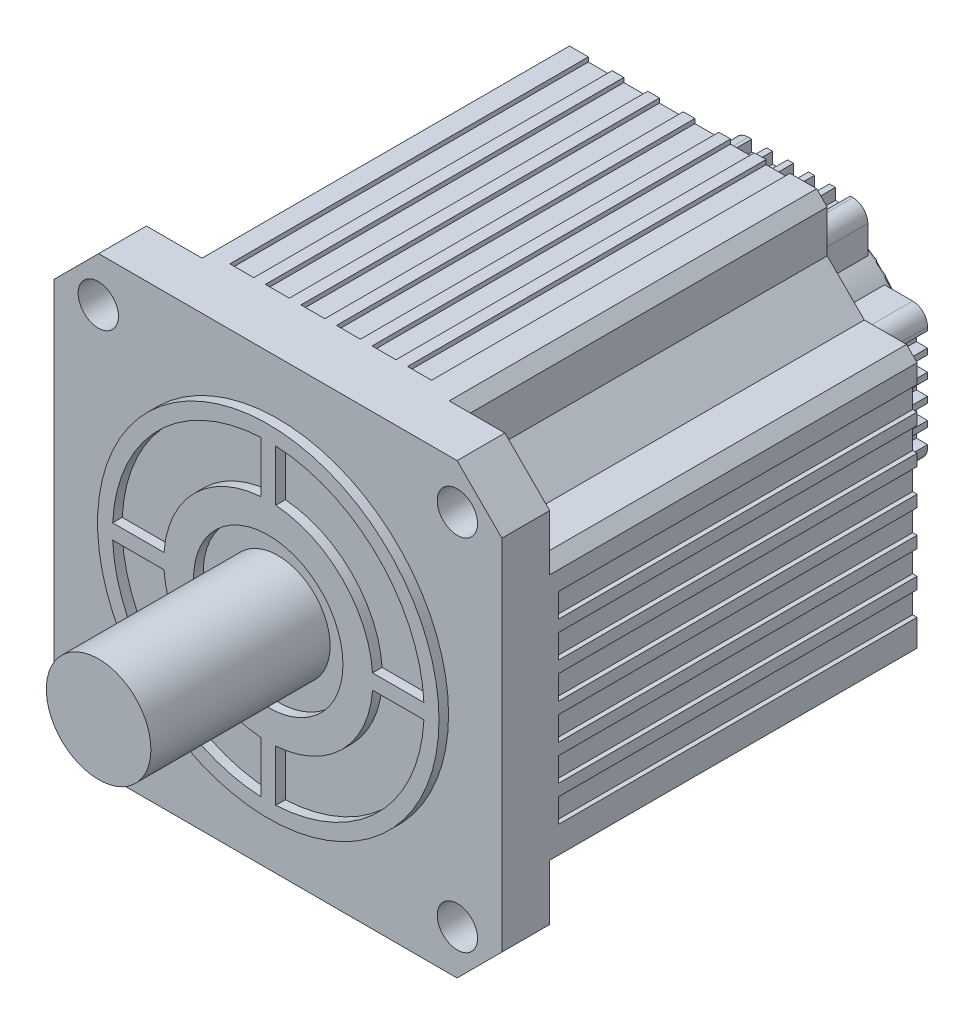
from build123d import *
from build123d.topology import SkipClean

# Parameters (mm, degrees)
EXTRUDE_1_DEPTH                     = 16
SKETCH_5_R                          = 57.15
EXTRUDE_2_DEPTH                     = 3.2
SKETCH_6_R                          = 52.15
CUT_EXTRUDE_3_DEPTH                 = 3.2
SKETCH_7_R                          = 17.5
EXTRUDE_4_DEPTH                     = 60
SKETCH_9_W                          = 29.28796894
SKETCH_9_H                          = 5
EXTRUDE_5_DEPTH                     = 3.2
PATTERN_CIRCULAR_1_COUNT            = 4
SKETCH_10_R                         = 35
SKETCH_10_R_2                       = 25
EXTRUDE_6_DEPTH                     = 3.2
EXTRUDE_7_DEPTH                     = 123
EXTRUDE_8_DEPTH                     = 36
SKETCH_13_R                         = 36.003209025
EXTRUDE_9_DEPTH                     = 2
FILLET_5_R                          = 1
SKETCH_14_W                         = 8
SKETCH_14_H                         = 13.851219487
CUT_EXTRUDE_10_DEPTH                = 120
SKETCH_15_W                         = 5
SKETCH_15_H                         = 4.986387051
CUT_EXTRUDE_11_DEPTH                = 44
PATTERN_LINEAR_4_COUNT              = 5
PATTERN_LINEAR_4_PITCH              = 7
EXTRUDE_12_DEPTH                    = 2
SKETCH_16_3_R                       = 1.5
EXTRUDE_13_DEPTH                    = 2
PATTERN_LINEAR_3_COUNT              = 6
PATTERN_LINEAR_3_PITCH              = 11.9
PATTERN_CIRCULAR_2_COUNT            = 4
PATTERN_CIRCULAR_2_COPY_1_SKETCH_W  = 8
PATTERN_CIRCULAR_2_COPY_1_SKETCH_H  = 13.851219487
PATTERN_CIRCULAR_2_COPY_1_DEPTH     = 120
PATTERN_CIRCULAR_2_COPY_2_SKETCH_W  = 8
PATTERN_CIRCULAR_2_COPY_2_SKETCH_H  = 13.851219487
PATTERN_CIRCULAR_2_COPY_2_DEPTH     = 120
PATTERN_CIRCULAR_2_COPY_3_SKETCH_W  = 8
PATTERN_CIRCULAR_2_COPY_3_SKETCH_H  = 13.851219487
PATTERN_CIRCULAR_2_COPY_3_DEPTH     = 120
PATTERN_CIRCULAR_2_COPY_4_SKETCH_W  = 8
PATTERN_CIRCULAR_2_COPY_4_SKETCH_H  = 13.851219487
PATTERN_CIRCULAR_2_COPY_4_DEPTH     = 120
PATTERN_CIRCULAR_2_COPY_5_SKETCH_W  = 8
PATTERN_CIRCULAR_2_COPY_5_SKETCH_H  = 13.851219487
PATTERN_CIRCULAR_2_COPY_5_DEPTH     = 120
PATTERN_CIRCULAR_2_COPY_6_SKETCH_W  = 8
PATTERN_CIRCULAR_2_COPY_6_SKETCH_H  = 13.851219487
PATTERN_CIRCULAR_2_COPY_6_DEPTH     = 120
PATTERN_CIRCULAR_2_COPY_7_SKETCH_W  = 8
PATTERN_CIRCULAR_2_COPY_7_SKETCH_H  = 13.851219487
PATTERN_CIRCULAR_2_COPY_7_DEPTH     = 120
PATTERN_CIRCULAR_2_COPY_8_SKETCH_W  = 8
PATTERN_CIRCULAR_2_COPY_8_SKETCH_H  = 13.851219487
PATTERN_CIRCULAR_2_COPY_8_DEPTH     = 120
PATTERN_CIRCULAR_2_COPY_9_SKETCH_W  = 8
PATTERN_CIRCULAR_2_COPY_9_SKETCH_H  = 13.851219487
PATTERN_CIRCULAR_2_COPY_9_DEPTH     = 120
PATTERN_CIRCULAR_2_COPY_10_SKETCH_W = 8
PATTERN_CIRCULAR_2_COPY_10_SKETCH_H = 13.851219487
PATTERN_CIRCULAR_2_COPY_10_DEPTH    = 120
PATTERN_CIRCULAR_2_COPY_11_SKETCH_W = 8
PATTERN_CIRCULAR_2_COPY_11_SKETCH_H = 13.851219487
PATTERN_CIRCULAR_2_COPY_11_DEPTH    = 120
PATTERN_CIRCULAR_2_COPY_12_SKETCH_W = 8
PATTERN_CIRCULAR_2_COPY_12_SKETCH_H = 13.851219487
PATTERN_CIRCULAR_2_COPY_12_DEPTH    = 120
PATTERN_CIRCULAR_2_COPY_13_SKETCH_W = 8
PATTERN_CIRCULAR_2_COPY_13_SKETCH_H = 13.851219487
PATTERN_CIRCULAR_2_COPY_13_DEPTH    = 120
PATTERN_CIRCULAR_2_COPY_14_SKETCH_W = 8
PATTERN_CIRCULAR_2_COPY_14_SKETCH_H = 13.851219487
PATTERN_CIRCULAR_2_COPY_14_DEPTH    = 120
PATTERN_CIRCULAR_2_COPY_15_SKETCH_W = 8
PATTERN_CIRCULAR_2_COPY_15_SKETCH_H = 13.851219487
PATTERN_CIRCULAR_2_COPY_15_DEPTH    = 120
PATTERN_CIRCULAR_3_COUNT            = 4
PATTERN_CIRCULAR_3_COPY_1_SKETCH_W  = 5
PATTERN_CIRCULAR_3_COPY_1_SKETCH_H  = 4.986387051
PATTERN_CIRCULAR_3_COPY_1_DEPTH     = 44
PATTERN_CIRCULAR_3_COPY_2_SKETCH_W  = 5
PATTERN_CIRCULAR_3_COPY_2_SKETCH_H  = 4.986387051
PATTERN_CIRCULAR_3_COPY_2_DEPTH     = 44
PATTERN_CIRCULAR_3_COPY_3_SKETCH_W  = 5
PATTERN_CIRCULAR_3_COPY_3_SKETCH_H  = 4.986387051
PATTERN_CIRCULAR_3_COPY_3_DEPTH     = 44
PATTERN_CIRCULAR_3_COPY_4_SKETCH_W  = 5
PATTERN_CIRCULAR_3_COPY_4_SKETCH_H  = 4.986387051
PATTERN_CIRCULAR_3_COPY_4_DEPTH     = 44
PATTERN_CIRCULAR_3_COPY_5_SKETCH_W  = 5
PATTERN_CIRCULAR_3_COPY_5_SKETCH_H  = 4.986387051
PATTERN_CIRCULAR_3_COPY_5_DEPTH     = 44
PATTERN_CIRCULAR_3_COPY_6_SKETCH_W  = 5
PATTERN_CIRCULAR_3_COPY_6_SKETCH_H  = 4.986387051
PATTERN_CIRCULAR_3_COPY_6_DEPTH     = 44
PATTERN_CIRCULAR_3_COPY_7_SKETCH_W  = 5
PATTERN_CIRCULAR_3_COPY_7_SKETCH_H  = 4.986387051
PATTERN_CIRCULAR_3_COPY_7_DEPTH     = 44
PATTERN_CIRCULAR_3_COPY_8_SKETCH_W  = 5
PATTERN_CIRCULAR_3_COPY_8_SKETCH_H  = 4.986387051
PATTERN_CIRCULAR_3_COPY_8_DEPTH     = 44
PATTERN_CIRCULAR_3_COPY_9_SKETCH_W  = 5
PATTERN_CIRCULAR_3_COPY_9_SKETCH_H  = 4.986387051
PATTERN_CIRCULAR_3_COPY_9_DEPTH     = 44
PATTERN_CIRCULAR_3_COPY_10_SKETCH_W = 5
PATTERN_CIRCULAR_3_COPY_10_SKETCH_H = 4.986387051
PATTERN_CIRCULAR_3_COPY_10_DEPTH    = 44
PATTERN_CIRCULAR_3_COPY_11_SKETCH_W = 5
PATTERN_CIRCULAR_3_COPY_11_SKETCH_H = 4.986387051
PATTERN_CIRCULAR_3_COPY_11_DEPTH    = 44
PATTERN_CIRCULAR_3_COPY_12_SKETCH_W = 5
PATTERN_CIRCULAR_3_COPY_12_SKETCH_H = 4.986387051
PATTERN_CIRCULAR_3_COPY_12_DEPTH    = 44
SKETCH_17_R                         = 6.75
CUT_EXTRUDE_15_DEPTH                = 30


with BuildPart() as part:
    # 草图1 → 拉伸1 (new body)
    with BuildSketch(Plane.XY):
        Polygon((-60, 75), (-75, 60), (-75, -60), (-60, -75), (60, -75), (75, -60), (75, 60), (60, 75), align=None)
    extrude(amount=EXTRUDE_1_DEPTH)

    # 草图5 → 拉伸2 (add)
    with BuildSketch(Plane.XY.offset(16)):
        Circle(SKETCH_5_R)
    extrude(amount=EXTRUDE_2_DEPTH)

    # 草图6 → 拉伸3 (cut)
    with BuildSketch(Plane.XY.offset(19.2)):
        Circle(SKETCH_6_R)
    extrude(amount=-CUT_EXTRUDE_3_DEPTH, mode=Mode.SUBTRACT)

    # 草图7 → 拉伸4 (add)
    with BuildSketch(Plane.XY.offset(16)):
        Circle(SKETCH_7_R)
    extrude(amount=EXTRUDE_4_DEPTH)

    # 草图9 → 拉伸5 (add)
    with BuildSketch(Plane.XY.offset(16)):
        with Locations((39.721687474, 0)):
            Rectangle(SKETCH_9_W, SKETCH_9_H)
    extrude_5 = extrude(amount=EXTRUDE_5_DEPTH)

    # 阵列(圆周)1: 拉伸5 ×4 about axis
    pattern_circular_1_axis = Axis((0, 0, 0), (0, 0, 1))
    for i in range(1, PATTERN_CIRCULAR_1_COUNT):
        add(extrude_5.rotate(pattern_circular_1_axis, i * 360 / PATTERN_CIRCULAR_1_COUNT))

    # 草图10 → 拉伸6 (add)
    with BuildSketch(Plane.XY.offset(16)):
        Circle(SKETCH_10_R)
        Circle(SKETCH_10_R_2, mode=Mode.SUBTRACT)
    extrude(amount=EXTRUDE_6_DEPTH)

    # 草图11 → 拉伸7 (add)
    with BuildSketch(Plane(origin=(0, 0, 0), x_dir=(-1, 0, 0), z_dir=(0, 0, -1))):
        Polygon((-75, 41.375735931), (-75, 11.872226679), (-75, -41.375735931), (-71.464466094, -44.911269837), (-57.32233047, -44.911269837), (-44.911269837, -57.32233047), (-44.911269837, -71.464466094), (-41.375735931, -75), (-11.872226679, -75), (41.375735931, -75), (44.911269837, -71.464466094), (44.911269837, -57.32233047), (57.32233047, -44.911269837), (71.464466094, -44.911269837), (75, -41.375735931), (75, -11.872226679), (75, 41.375735931), (71.464466094, 44.911269837), (57.32233047, 44.911269837), (44.911269837, 57.32233047), (44.911269837, 71.464466094), (41.375735931, 75), (11.872226679, 75), (-41.375735931, 75), (-44.911269837, 71.464466094), (-44.911269837, 57.32233047), (-57.32233047, 44.911269837), (-71.464466094, 44.911269837), align=None)
    extrude(amount=EXTRUDE_7_DEPTH)

    # 草图12 → 拉伸8 (add)
    with BuildSketch(Plane(origin=(0, 0, -123), x_dir=(-1, 0, 0), z_dir=(0, 0, -1))):
        with BuildLine():
            Line((-42.5, -17.5), (-42.5, 17.5))
            ThreePointArc((-42.5, 17.5), (-41.035533906, 21.035533906), (-37.5, 22.5))
            Line((-37.5, 22.5), (-28.106601718, 22.5))
            ThreePointArc((-28.106601718, 22.5), (-25.458113246, 25.458113246), (-22.5, 28.106601718))
            Line((-22.5, 28.106601718), (-22.5, 37.496601718))
            ThreePointArc((-22.5, 37.496601718), (-21.035533906, 41.032135624), (-17.5, 42.496601718))
            Line((-17.5, 42.496601718), (17.5, 42.496601718))
            ThreePointArc((17.5, 42.496601718), (21.035533906, 41.032135624), (22.5, 37.496601718))
            Line((22.5, 37.496601718), (22.5, 28.106601718))
            ThreePointArc((22.5, 28.106601718), (25.458113246, 25.458113246), (28.106601718, 22.5))
            Line((28.106601718, 22.5), (37.5, 22.5))
            ThreePointArc((37.5, 22.5), (41.035533906, 21.035533906), (42.5, 17.5))
            Line((42.5, 17.5), (42.5, -17.5))
            ThreePointArc((42.5, -17.5), (41.035533906, -21.035533906), (37.5, -22.5))
            Line((37.5, -22.5), (28.106601718, -22.5))
            ThreePointArc((28.106601718, -22.5), (25.458113246, -25.458113246), (22.5, -28.106601718))
            Line((22.5, -28.106601718), (22.5, -37.5))
            ThreePointArc((22.5, -37.5), (21.035533906, -41.035533906), (17.5, -42.5))
            Line((17.5, -42.5), (-17.5, -42.5))
            ThreePointArc((-17.5, -42.5), (-21.035533906, -41.035533906), (-22.5, -37.5))
            Line((-22.5, -37.5), (-22.5, -28.106601718))
            ThreePointArc((-22.5, -28.106601718), (-25.458113246, -25.458113246), (-28.106601718, -22.5))
            Line((-28.106601718, -22.5), (-37.5, -22.5))
            ThreePointArc((-37.5, -22.5), (-41.035533906, -21.035533906), (-42.5, -17.5))
        make_face()
    extrude(amount=EXTRUDE_8_DEPTH)

    # 草图13 → 拉伸9 (add)
    with BuildSketch(Plane(origin=(0, 0, -159), x_dir=(-1, 0, 0), z_dir=(0, 0, -1))):
        with Locations(Location((0, 0, 0), (0, 0, 218.678098804))):
            Circle(SKETCH_13_R)
    extrude(amount=EXTRUDE_9_DEPTH)

    # 圆角5
    fillet_5_edges = [part.edges().sort_by_distance(p)[0] for p in [
        (-28.106601718, 22.5, -161),
    ]]
    fillet(fillet_5_edges, radius=FILLET_5_R)

    # 草图14 → 拉伸10 (cut)
    with SkipClean():  # the faces are left unmerged after this step: merging them gives an invalid solid
        with BuildSketch(Plane(origin=(0, 0, -123), x_dir=(-1, 0, 0), z_dir=(0, 0, -1))):
            with Locations((-28.437637144, 80.428126698)):
                Rectangle(SKETCH_14_W, SKETCH_14_H)
        cut_extrude_10 = extrude(amount=-CUT_EXTRUDE_10_DEPTH, mode=Mode.SUBTRACT)

    # 草图15 → 拉伸11 (cut)
    with SkipClean():  # the faces are left unmerged after this step: merging them gives an invalid solid
        with BuildSketch(Plane(origin=(0, 0, -159), x_dir=(-1, 0, 0), z_dir=(0, 0, -1))):
            with Locations((-13.879356153, -41.240442285)):
                Rectangle(SKETCH_15_W, SKETCH_15_H)
        cut_extrude_11 = extrude(amount=-CUT_EXTRUDE_11_DEPTH, mode=Mode.SUBTRACT)

    # 阵列(线性)4: 拉伸11 ×5
    with SkipClean():  # the faces are left unmerged after this step: merging them gives an invalid solid
        with Locations(*[(-i * PATTERN_LINEAR_4_PITCH, 0, 0) for i in range(1, PATTERN_LINEAR_4_COUNT)]):
            add(cut_extrude_11, mode=Mode.SUBTRACT)

    # 草图16 → 拉伸12 (add)
    with SkipClean():  # the faces are left unmerged after this step: merging them gives an invalid solid
        with BuildSketch(Plane(origin=(0, 0, -161), x_dir=(-1, 0, 0), z_dir=(0, 0, -1))):
            with BuildLine():
                Line((13.498025706, 12.925098524), (3.778424262, 12.925098524))
                Line((3.778424262, 12.925098524), (-4.48952493, 12.925098524))
                ThreePointArc((-4.48952493, 12.925098524), (-5.355550334, 12.425098524), (-5.355550334, 11.425098524))
                Line((-5.355550334, 11.425098524), (-2.087601141, 5.764844486))
                ThreePointArc((-2.087601141, 5.764844486), (-1.221575738, 5.264844486), (-0.355550334, 5.764844486))
                Line((-0.355550334, 5.764844486), (2.912398859, 11.425098524))
                ThreePointArc((2.912398859, 11.425098524), (3.778424262, 11.925098524), (4.644449666, 11.425098524))
                Line((4.644449666, 11.425098524), (7.912398859, 5.764844486))
                ThreePointArc((7.912398859, 5.764844486), (7.912398859, 4.764844486), (7.046373455, 4.264844486))
                Line((7.046373455, 4.264844486), (-9.48952493, 4.264844486))
                ThreePointArc((-9.48952493, 4.264844486), (-10.355550334, 4.764844486), (-10.355550334, 5.764844486))
                Line((-10.355550334, 5.764844486), (-2.087601141, 20.085352561))
                ThreePointArc((-2.087601141, 20.085352561), (-1.221575738, 20.585352561), (-0.355550334, 20.085352561))
                Line((-0.355550334, 20.085352561), (2.912398859, 14.425098524))
                ThreePointArc((2.912398859, 14.425098524), (3.278424262, 14.05907312), (3.778424262, 13.925098524))
                Line((3.778424262, 13.925098524), (13.266114347, 13.925098524))
                ThreePointArc((13.266114347, 13.925098524), (-16.092946745, 8.078162398), (13.778424262, 10.038347178))
                ThreePointArc((13.778424262, 10.038347178), (13.708160055, 11.488515847), (13.498025706, 12.925098524))
            make_face()
        extrude(amount=EXTRUDE_12_DEPTH)

    # 草图16<3> → 拉伸13 (add)
    with SkipClean():  # the faces are left unmerged after this step: merging them gives an invalid solid
        with BuildSketch(Plane(origin=(0, 0, -161), x_dir=(-1, 0, 0), z_dir=(0, 0, -1))):
            with BuildLine():
                Line((-9.798250078, -13.165637846), (-9.798250078, -14.565637846))
                ThreePointArc((-9.798250078, -14.565637846), (-9.886118043, -14.77776988), (-10.098250078, -14.865637846))
                Line((-10.098250078, -14.865637846), (-12.798250078, -14.865637846))
                Line((-12.798250078, -14.865637846), (-12.798250078, -10.865637846))
                Line((-12.798250078, -10.865637846), (-6.798250078, -10.865637846))
                Line((-6.798250078, -10.865637846), (-6.798250078, -9.865637846))
                Line((-6.798250078, -9.865637846), (-14.798250078, -9.865637846))
                ThreePointArc((-14.798250078, -9.865637846), (-15.505356859, -10.158531065), (-15.798250078, -10.865637846))
                Line((-15.798250078, -10.865637846), (-15.798250078, -14.865637846))
                ThreePointArc((-15.798250078, -14.865637846), (-15.505356859, -15.572744627), (-14.798250078, -15.865637846))
                Line((-14.798250078, -15.865637846), (-6.798250078, -15.865637846))
                Line((-6.798250078, -15.865637846), (-6.798250078, -11.790340586))
                Line((-6.798250078, -11.790340586), (-10.798250078, -11.790340586))
                Line((-10.798250078, -11.790340586), (-10.798250078, -12.865637846))
                Line((-10.798250078, -12.865637846), (-10.098250078, -12.865637846))
                ThreePointArc((-10.098250078, -12.865637846), (-9.886118043, -12.953505811), (-9.798250078, -13.165637846))
            make_face()
            with BuildLine():
                ThreePointArc((0.434140924, -14.749084196), (0.646272958, -14.661216231), (0.734140924, -14.449084196))
                Line((0.734140924, -14.449084196), (0.734140924, -14.165637846))
                ThreePointArc((0.734140924, -14.165637846), (0.646272958, -13.953505811), (0.434140924, -13.865637846))
                Line((0.434140924, -13.865637846), (-4.265859076, -13.865637846))
                ThreePointArc((-4.265859076, -13.865637846), (-4.972965857, -13.572744627), (-5.265859076, -12.865637846))
                Line((-5.265859076, -12.865637846), (-5.265859076, -10.865637846))
                ThreePointArc((-5.265859076, -10.865637846), (-4.972965857, -10.158531065), (-4.265859076, -9.865637846))
                Line((-4.265859076, -9.865637846), (3.734140924, -9.865637846))
                Line((3.734140924, -9.865637846), (3.734140924, -10.865637846))
                Line((3.734140924, -10.865637846), (-1.965859076, -10.865637846))
                ThreePointArc((-1.965859076, -10.865637846), (-2.17799111, -10.953505811), (-2.265859076, -11.165637846))
                Line((-2.265859076, -11.165637846), (-2.265859076, -11.565637846))
                ThreePointArc((-2.265859076, -11.565637846), (-2.17799111, -11.77776988), (-1.965859076, -11.865637846))
                Line((-1.965859076, -11.865637846), (2.734140924, -11.865637846))
                ThreePointArc((2.734140924, -11.865637846), (3.441247705, -12.158531065), (3.734140924, -12.865637846))
                Line((3.734140924, -12.865637846), (3.734140924, -14.865637846))
                ThreePointArc((3.734140924, -14.865637846), (3.441247705, -15.572744627), (2.734140924, -15.865637846))
                Line((2.734140924, -15.865637846), (-5.265859076, -15.865637846))
                Line((-5.265859076, -15.865637846), (-5.265859076, -14.749084196))
                Line((-5.265859076, -14.749084196), (0.434140924, -14.749084196))
            make_face()
            Polygon((6.120189581, -9.865637846), (6.120189581, -15.865637846), (9.120189581, -15.865637846), (9.120189581, -14.365637846), (11.691618152, -15.865637846), (15.120189581, -15.865637846), (9.120189581, -12.365637846), (9.120189581, -9.865637846), align=None)
            with Locations((12.244660914, -11.202039893)):
                Circle(SKETCH_16_3_R)
        extrude(amount=EXTRUDE_13_DEPTH)

    # 阵列(线性)3: 拉伸10 ×6
    with SkipClean():  # the faces are left unmerged after this step: merging them gives an invalid solid
        with Locations(*[(-i * PATTERN_LINEAR_3_PITCH, 0, 0) for i in range(1, PATTERN_LINEAR_3_COUNT)]):
            add(cut_extrude_10, mode=Mode.SUBTRACT)

    # 阵列(圆周)2: 拉伸10 ×4 about axis
    with SkipClean():  # the faces are left unmerged after this step: merging them gives an invalid solid
        pattern_circular_2_axis = Axis((0, 0, 0), (0, 0, 1))
        for i in range(1, PATTERN_CIRCULAR_2_COUNT):
            add(cut_extrude_10.rotate(pattern_circular_2_axis, i * 360 / PATTERN_CIRCULAR_2_COUNT), mode=Mode.SUBTRACT)

    # 阵列(圆周)2 copy 1 sketch → 阵列(圆周)2 copy 1 (cut)
    with SkipClean():  # the faces are left unmerged after this step: merging them gives an invalid solid
        with BuildSketch(Plane(origin=(0, -11.9, -123), x_dir=(0, -1, 0), z_dir=(0, 0, -1))):
            with Locations((-28.437637144, 80.428126698)):
                Rectangle(PATTERN_CIRCULAR_2_COPY_1_SKETCH_W, PATTERN_CIRCULAR_2_COPY_1_SKETCH_H)
        extrude(amount=-PATTERN_CIRCULAR_2_COPY_1_DEPTH, mode=Mode.SUBTRACT)

    # 阵列(圆周)2 copy 2 sketch → 阵列(圆周)2 copy 2 (cut)
    with SkipClean():  # the faces are left unmerged after this step: merging them gives an invalid solid
        with BuildSketch(Plane(origin=(11.9, 0, -123), x_dir=(1, 0, 0), z_dir=(0, 0, -1))):
            with Locations((-28.437637144, 80.428126698)):
                Rectangle(PATTERN_CIRCULAR_2_COPY_2_SKETCH_W, PATTERN_CIRCULAR_2_COPY_2_SKETCH_H)
        extrude(amount=-PATTERN_CIRCULAR_2_COPY_2_DEPTH, mode=Mode.SUBTRACT)

    # 阵列(圆周)2 copy 3 sketch → 阵列(圆周)2 copy 3 (cut)
    with SkipClean():  # the faces are left unmerged after this step: merging them gives an invalid solid
        with BuildSketch(Plane(origin=(0, 11.9, -123), x_dir=(0, 1, 0), z_dir=(0, 0, -1))):
            with Locations((-28.437637144, 80.428126698)):
                Rectangle(PATTERN_CIRCULAR_2_COPY_3_SKETCH_W, PATTERN_CIRCULAR_2_COPY_3_SKETCH_H)
        extrude(amount=-PATTERN_CIRCULAR_2_COPY_3_DEPTH, mode=Mode.SUBTRACT)

    # 阵列(圆周)2 copy 4 sketch → 阵列(圆周)2 copy 4 (cut)
    with SkipClean():  # the faces are left unmerged after this step: merging them gives an invalid solid
        with BuildSketch(Plane(origin=(0, -23.8, -123), x_dir=(0, -1, 0), z_dir=(0, 0, -1))):
            with Locations((-28.437637144, 80.428126698)):
                Rectangle(PATTERN_CIRCULAR_2_COPY_4_SKETCH_W, PATTERN_CIRCULAR_2_COPY_4_SKETCH_H)
        extrude(amount=-PATTERN_CIRCULAR_2_COPY_4_DEPTH, mode=Mode.SUBTRACT)

    # 阵列(圆周)2 copy 5 sketch → 阵列(圆周)2 copy 5 (cut)
    with SkipClean():  # the faces are left unmerged after this step: merging them gives an invalid solid
        with BuildSketch(Plane(origin=(23.8, 0, -123), x_dir=(1, 0, 0), z_dir=(0, 0, -1))):
            with Locations((-28.437637144, 80.428126698)):
                Rectangle(PATTERN_CIRCULAR_2_COPY_5_SKETCH_W, PATTERN_CIRCULAR_2_COPY_5_SKETCH_H)
        extrude(amount=-PATTERN_CIRCULAR_2_COPY_5_DEPTH, mode=Mode.SUBTRACT)

    # 阵列(圆周)2 copy 6 sketch → 阵列(圆周)2 copy 6 (cut)
    with SkipClean():  # the faces are left unmerged after this step: merging them gives an invalid solid
        with BuildSketch(Plane(origin=(0, 23.8, -123), x_dir=(0, 1, 0), z_dir=(0, 0, -1))):
            with Locations((-28.437637144, 80.428126698)):
                Rectangle(PATTERN_CIRCULAR_2_COPY_6_SKETCH_W, PATTERN_CIRCULAR_2_COPY_6_SKETCH_H)
        extrude(amount=-PATTERN_CIRCULAR_2_COPY_6_DEPTH, mode=Mode.SUBTRACT)

    # 阵列(圆周)2 copy 7 sketch → 阵列(圆周)2 copy 7 (cut)
    with SkipClean():  # the faces are left unmerged after this step: merging them gives an invalid solid
        with BuildSketch(Plane(origin=(0, -35.7, -123), x_dir=(0, -1, 0), z_dir=(0, 0, -1))):
            with Locations((-28.437637144, 80.428126698)):
                Rectangle(PATTERN_CIRCULAR_2_COPY_7_SKETCH_W, PATTERN_CIRCULAR_2_COPY_7_SKETCH_H)
        extrude(amount=-PATTERN_CIRCULAR_2_COPY_7_DEPTH, mode=Mode.SUBTRACT)

    # 阵列(圆周)2 copy 8 sketch → 阵列(圆周)2 copy 8 (cut)
    with SkipClean():  # the faces are left unmerged after this step: merging them gives an invalid solid
        with BuildSketch(Plane(origin=(35.7, 0, -123), x_dir=(1, 0, 0), z_dir=(0, 0, -1))):
            with Locations((-28.437637144, 80.428126698)):
                Rectangle(PATTERN_CIRCULAR_2_COPY_8_SKETCH_W, PATTERN_CIRCULAR_2_COPY_8_SKETCH_H)
        extrude(amount=-PATTERN_CIRCULAR_2_COPY_8_DEPTH, mode=Mode.SUBTRACT)

    # 阵列(圆周)2 copy 9 sketch → 阵列(圆周)2 copy 9 (cut)
    with SkipClean():  # the faces are left unmerged after this step: merging them gives an invalid solid
        with BuildSketch(Plane(origin=(0, 35.7, -123), x_dir=(0, 1, 0), z_dir=(0, 0, -1))):
            with Locations((-28.437637144, 80.428126698)):
                Rectangle(PATTERN_CIRCULAR_2_COPY_9_SKETCH_W, PATTERN_CIRCULAR_2_COPY_9_SKETCH_H)
        extrude(amount=-PATTERN_CIRCULAR_2_COPY_9_DEPTH, mode=Mode.SUBTRACT)

    # 阵列(圆周)2 copy 10 sketch → 阵列(圆周)2 copy 10 (cut)
    with SkipClean():  # the faces are left unmerged after this step: merging them gives an invalid solid
        with BuildSketch(Plane(origin=(0, -47.6, -123), x_dir=(0, -1, 0), z_dir=(0, 0, -1))):
            with Locations((-28.437637144, 80.428126698)):
                Rectangle(PATTERN_CIRCULAR_2_COPY_10_SKETCH_W, PATTERN_CIRCULAR_2_COPY_10_SKETCH_H)
        extrude(amount=-PATTERN_CIRCULAR_2_COPY_10_DEPTH, mode=Mode.SUBTRACT)

    # 阵列(圆周)2 copy 11 sketch → 阵列(圆周)2 copy 11 (cut)
    with SkipClean():  # the faces are left unmerged after this step: merging them gives an invalid solid
        with BuildSketch(Plane(origin=(47.6, 0, -123), x_dir=(1, 0, 0), z_dir=(0, 0, -1))):
            with Locations((-28.437637144, 80.428126698)):
                Rectangle(PATTERN_CIRCULAR_2_COPY_11_SKETCH_W, PATTERN_CIRCULAR_2_COPY_11_SKETCH_H)
        extrude(amount=-PATTERN_CIRCULAR_2_COPY_11_DEPTH, mode=Mode.SUBTRACT)

    # 阵列(圆周)2 copy 12 sketch → 阵列(圆周)2 copy 12 (cut)
    with SkipClean():  # the faces are left unmerged after this step: merging them gives an invalid solid
        with BuildSketch(Plane(origin=(0, 47.6, -123), x_dir=(0, 1, 0), z_dir=(0, 0, -1))):
            with Locations((-28.437637144, 80.428126698)):
                Rectangle(PATTERN_CIRCULAR_2_COPY_12_SKETCH_W, PATTERN_CIRCULAR_2_COPY_12_SKETCH_H)
        extrude(amount=-PATTERN_CIRCULAR_2_COPY_12_DEPTH, mode=Mode.SUBTRACT)

    # 阵列(圆周)2 copy 13 sketch → 阵列(圆周)2 copy 13 (cut)
    with SkipClean():  # the faces are left unmerged after this step: merging them gives an invalid solid
        with BuildSketch(Plane(origin=(0, -59.5, -123), x_dir=(0, -1, 0), z_dir=(0, 0, -1))):
            with Locations((-28.437637144, 80.428126698)):
                Rectangle(PATTERN_CIRCULAR_2_COPY_13_SKETCH_W, PATTERN_CIRCULAR_2_COPY_13_SKETCH_H)
        extrude(amount=-PATTERN_CIRCULAR_2_COPY_13_DEPTH, mode=Mode.SUBTRACT)

    # 阵列(圆周)2 copy 14 sketch → 阵列(圆周)2 copy 14 (cut)
    with SkipClean():  # the faces are left unmerged after this step: merging them gives an invalid solid
        with BuildSketch(Plane(origin=(59.5, 0, -123), x_dir=(1, 0, 0), z_dir=(0, 0, -1))):
            with Locations((-28.437637144, 80.428126698)):
                Rectangle(PATTERN_CIRCULAR_2_COPY_14_SKETCH_W, PATTERN_CIRCULAR_2_COPY_14_SKETCH_H)
        extrude(amount=-PATTERN_CIRCULAR_2_COPY_14_DEPTH, mode=Mode.SUBTRACT)

    # 阵列(圆周)2 copy 15 sketch → 阵列(圆周)2 copy 15 (cut)
    with SkipClean():  # the faces are left unmerged after this step: merging them gives an invalid solid
        with BuildSketch(Plane(origin=(0, 59.5, -123), x_dir=(0, 1, 0), z_dir=(0, 0, -1))):
            with Locations((-28.437637144, 80.428126698)):
                Rectangle(PATTERN_CIRCULAR_2_COPY_15_SKETCH_W, PATTERN_CIRCULAR_2_COPY_15_SKETCH_H)
        extrude(amount=-PATTERN_CIRCULAR_2_COPY_15_DEPTH, mode=Mode.SUBTRACT)

    # 阵列(圆周)3: 拉伸11 ×4 about axis
    with SkipClean():  # the faces are left unmerged after this step: merging them gives an invalid solid
        pattern_circular_3_axis = Axis((0, 0, 0), (0, 0, 1))
        for i in range(1, PATTERN_CIRCULAR_3_COUNT):
            add(cut_extrude_11.rotate(pattern_circular_3_axis, i * 360 / PATTERN_CIRCULAR_3_COUNT), mode=Mode.SUBTRACT)

    # 阵列(圆周)3 copy 1 sketch → 阵列(圆周)3 copy 1 (cut)
    with SkipClean():  # the faces are left unmerged after this step: merging them gives an invalid solid
        with BuildSketch(Plane(origin=(0, -7, -159), x_dir=(0, -1, 0), z_dir=(0, 0, -1))):
            with Locations((-13.879356153, -41.240442285)):
                Rectangle(PATTERN_CIRCULAR_3_COPY_1_SKETCH_W, PATTERN_CIRCULAR_3_COPY_1_SKETCH_H)
        extrude(amount=-PATTERN_CIRCULAR_3_COPY_1_DEPTH, mode=Mode.SUBTRACT)

    # 阵列(圆周)3 copy 2 sketch → 阵列(圆周)3 copy 2 (cut)
    with SkipClean():  # the faces are left unmerged after this step: merging them gives an invalid solid
        with BuildSketch(Plane(origin=(7, 0, -159), x_dir=(1, 0, 0), z_dir=(0, 0, -1))):
            with Locations((-13.879356153, -41.240442285)):
                Rectangle(PATTERN_CIRCULAR_3_COPY_2_SKETCH_W, PATTERN_CIRCULAR_3_COPY_2_SKETCH_H)
        extrude(amount=-PATTERN_CIRCULAR_3_COPY_2_DEPTH, mode=Mode.SUBTRACT)

    # 阵列(圆周)3 copy 3 sketch → 阵列(圆周)3 copy 3 (cut)
    with SkipClean():  # the faces are left unmerged after this step: merging them gives an invalid solid
        with BuildSketch(Plane(origin=(0, 7, -159), x_dir=(0, 1, 0), z_dir=(0, 0, -1))):
            with Locations((-13.879356153, -41.240442285)):
                Rectangle(PATTERN_CIRCULAR_3_COPY_3_SKETCH_W, PATTERN_CIRCULAR_3_COPY_3_SKETCH_H)
        extrude(amount=-PATTERN_CIRCULAR_3_COPY_3_DEPTH, mode=Mode.SUBTRACT)

    # 阵列(圆周)3 copy 4 sketch → 阵列(圆周)3 copy 4 (cut)
    with SkipClean():  # the faces are left unmerged after this step: merging them gives an invalid solid
        with BuildSketch(Plane(origin=(0, -14, -159), x_dir=(0, -1, 0), z_dir=(0, 0, -1))):
            with Locations((-13.879356153, -41.240442285)):
                Rectangle(PATTERN_CIRCULAR_3_COPY_4_SKETCH_W, PATTERN_CIRCULAR_3_COPY_4_SKETCH_H)
        extrude(amount=-PATTERN_CIRCULAR_3_COPY_4_DEPTH, mode=Mode.SUBTRACT)

    # 阵列(圆周)3 copy 5 sketch → 阵列(圆周)3 copy 5 (cut)
    with SkipClean():  # the faces are left unmerged after this step: merging them gives an invalid solid
        with BuildSketch(Plane(origin=(14, 0, -159), x_dir=(1, 0, 0), z_dir=(0, 0, -1))):
            with Locations((-13.879356153, -41.240442285)):
                Rectangle(PATTERN_CIRCULAR_3_COPY_5_SKETCH_W, PATTERN_CIRCULAR_3_COPY_5_SKETCH_H)
        extrude(amount=-PATTERN_CIRCULAR_3_COPY_5_DEPTH, mode=Mode.SUBTRACT)

    # 阵列(圆周)3 copy 6 sketch → 阵列(圆周)3 copy 6 (cut)
    with SkipClean():  # the faces are left unmerged after this step: merging them gives an invalid solid
        with BuildSketch(Plane(origin=(0, 14, -159), x_dir=(0, 1, 0), z_dir=(0, 0, -1))):
            with Locations((-13.879356153, -41.240442285)):
                Rectangle(PATTERN_CIRCULAR_3_COPY_6_SKETCH_W, PATTERN_CIRCULAR_3_COPY_6_SKETCH_H)
        extrude(amount=-PATTERN_CIRCULAR_3_COPY_6_DEPTH, mode=Mode.SUBTRACT)

    # 阵列(圆周)3 copy 7 sketch → 阵列(圆周)3 copy 7 (cut)
    with SkipClean():  # the faces are left unmerged after this step: merging them gives an invalid solid
        with BuildSketch(Plane(origin=(0, -21, -159), x_dir=(0, -1, 0), z_dir=(0, 0, -1))):
            with Locations((-13.879356153, -41.240442285)):
                Rectangle(PATTERN_CIRCULAR_3_COPY_7_SKETCH_W, PATTERN_CIRCULAR_3_COPY_7_SKETCH_H)
        extrude(amount=-PATTERN_CIRCULAR_3_COPY_7_DEPTH, mode=Mode.SUBTRACT)

    # 阵列(圆周)3 copy 8 sketch → 阵列(圆周)3 copy 8 (cut)
    with SkipClean():  # the faces are left unmerged after this step: merging them gives an invalid solid
        with BuildSketch(Plane(origin=(21, 0, -159), x_dir=(1, 0, 0), z_dir=(0, 0, -1))):
            with Locations((-13.879356153, -41.240442285)):
                Rectangle(PATTERN_CIRCULAR_3_COPY_8_SKETCH_W, PATTERN_CIRCULAR_3_COPY_8_SKETCH_H)
        extrude(amount=-PATTERN_CIRCULAR_3_COPY_8_DEPTH, mode=Mode.SUBTRACT)

    # 阵列(圆周)3 copy 9 sketch → 阵列(圆周)3 copy 9 (cut)
    with SkipClean():  # the faces are left unmerged after this step: merging them gives an invalid solid
        with BuildSketch(Plane(origin=(0, 21, -159), x_dir=(0, 1, 0), z_dir=(0, 0, -1))):
            with Locations((-13.879356153, -41.240442285)):
                Rectangle(PATTERN_CIRCULAR_3_COPY_9_SKETCH_W, PATTERN_CIRCULAR_3_COPY_9_SKETCH_H)
        extrude(amount=-PATTERN_CIRCULAR_3_COPY_9_DEPTH, mode=Mode.SUBTRACT)

    # 阵列(圆周)3 copy 10 sketch → 阵列(圆周)3 copy 10 (cut)
    with SkipClean():  # the faces are left unmerged after this step: merging them gives an invalid solid
        with BuildSketch(Plane(origin=(0, -28, -159), x_dir=(0, -1, 0), z_dir=(0, 0, -1))):
            with Locations((-13.879356153, -41.240442285)):
                Rectangle(PATTERN_CIRCULAR_3_COPY_10_SKETCH_W, PATTERN_CIRCULAR_3_COPY_10_SKETCH_H)
        extrude(amount=-PATTERN_CIRCULAR_3_COPY_10_DEPTH, mode=Mode.SUBTRACT)

    # 阵列(圆周)3 copy 11 sketch → 阵列(圆周)3 copy 11 (cut)
    with SkipClean():  # the faces are left unmerged after this step: merging them gives an invalid solid
        with BuildSketch(Plane(origin=(28, 0, -159), x_dir=(1, 0, 0), z_dir=(0, 0, -1))):
            with Locations((-13.879356153, -41.240442285)):
                Rectangle(PATTERN_CIRCULAR_3_COPY_11_SKETCH_W, PATTERN_CIRCULAR_3_COPY_11_SKETCH_H)
        extrude(amount=-PATTERN_CIRCULAR_3_COPY_11_DEPTH, mode=Mode.SUBTRACT)

    # 阵列(圆周)3 copy 12 sketch → 阵列(圆周)3 copy 12 (cut)
    with SkipClean():  # the faces are left unmerged after this step: merging them gives an invalid solid
        with BuildSketch(Plane(origin=(0, 28, -159), x_dir=(0, 1, 0), z_dir=(0, 0, -1))):
            with Locations((-13.879356153, -41.240442285)):
                Rectangle(PATTERN_CIRCULAR_3_COPY_12_SKETCH_W, PATTERN_CIRCULAR_3_COPY_12_SKETCH_H)
        extrude(amount=-PATTERN_CIRCULAR_3_COPY_12_DEPTH, mode=Mode.SUBTRACT)

    # 草图17 → 拉伸15 (cut)
    with SkipClean():  # the faces are left unmerged after this step: merging them gives an invalid solid
        with BuildSketch(Plane.XY.offset(16)):
            with Locations((-60.104076401, 60.104076401)):
                Circle(SKETCH_17_R)
            with Locations((60.104076401, 60.104076401)):
                Circle(SKETCH_17_R)
            with Locations((60.104076401, -60.104076401)):
                Circle(SKETCH_17_R)
            with Locations((-60.104076401, -60.104076401)):
                Circle(SKETCH_17_R)
        extrude(amount=-CUT_EXTRUDE_15_DEPTH, mode=Mode.SUBTRACT)


solid = part.part
